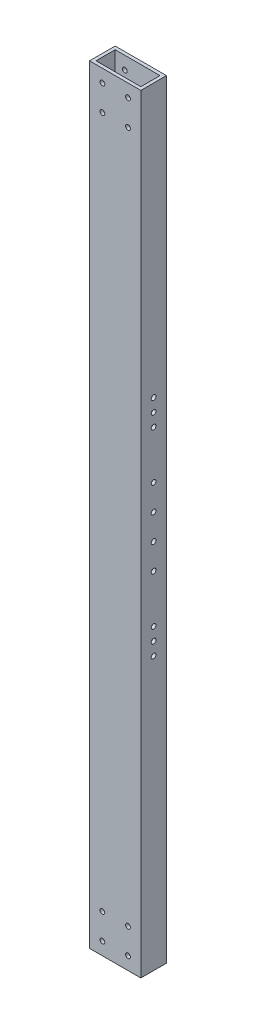
from build123d import *

# Parameters (mm, degrees)
SKETCH1_W               = 50.8
SKETCH1_H               = 25.4
BOSS_EXTRUDE1_DEPTH     = 381
SHELL1_T                = -3.175
SKETCH4_R               = 2.38125
CUT_EXTRUDE1_DEPTH      = 385.581499815
CUT_EXTRUDE2_DEPTH      = 383.689587002
CUT_EXTRUDE2_DEPTH_BACK = 383.689587002
SKETCH5_R               = 2.38125


with BuildPart() as part:
    # Sketch1 → Boss-Extrude1 (new, symmetric)
    with BuildSketch(Plane(origin=(0, 0, 0), x_dir=(1, 0, 0), z_dir=(0, 1, 0))):
        Rectangle(SKETCH1_W, SKETCH1_H)
    extrude(amount=BOSS_EXTRUDE1_DEPTH, both=True)

    # Shell1
    shell1_openings = [part.faces().sort_by_distance(p)[0] for p in [
        (0, 381, 0),
        (0, -381, 0),
    ]]
    offset(amount=SHELL1_T, openings=shell1_openings, kind=Kind.INTERSECTION)

    # Sketch4 → Cut-Extrude1 (cut, through all)
    with BuildSketch(Plane(origin=(25.4, 0, 0), x_dir=(0, 0, -1), z_dir=(1, 0, 0))):
        with Locations((0, 110.9345)):
            Circle(SKETCH4_R)
        with Locations((0, 98.2345)):
            Circle(SKETCH4_R)
        with Locations((0, 85.5345)):
            Circle(SKETCH4_R)
        with Locations(Location((0, -85.5345, 0), (0, 0, 180))):
            Circle(SKETCH4_R)
        with Locations(Location((0, -98.2345, 0), (0, 0, 180))):
            Circle(SKETCH4_R)
        with Locations(Location((0, -110.9345, 0), (0, 0, 180))):
            Circle(SKETCH4_R)
        with Locations((0, -12.7)):
            Circle(SKETCH4_R)
        with Locations((0, -38.1)):
            Circle(SKETCH4_R)
        with Locations(Location((0, 38.1, 0), (0, 0, 180))):
            Circle(SKETCH4_R)
        with Locations(Location((0, 12.7, 0), (0, 0, 180))):
            Circle(SKETCH4_R)
    extrude(amount=-CUT_EXTRUDE1_DEPTH, mode=Mode.SUBTRACT)

    # Sketch5 → Cut-Extrude2 (cut, two sides: drawn at the far end of the back side and taken through both)
    with BuildSketch(Plane.XY.offset(12.7).offset(-CUT_EXTRUDE2_DEPTH_BACK)):
        with Locations((-12.7, 368.3)):
            Circle(SKETCH5_R)
        with Locations((12.7, 368.3)):
            Circle(SKETCH5_R)
        with Locations((12.7, 342.9)):
            Circle(SKETCH5_R)
        with Locations((-12.7, 342.9)):
            Circle(SKETCH5_R)
        with Locations((-12.7, -342.9)):
            Circle(SKETCH5_R)
        with Locations((12.7, -342.9)):
            Circle(SKETCH5_R)
        with Locations((12.7, -368.3)):
            Circle(SKETCH5_R)
        with Locations((-12.7, -368.3)):
            Circle(SKETCH5_R)
    extrude(amount=CUT_EXTRUDE2_DEPTH + CUT_EXTRUDE2_DEPTH_BACK, mode=Mode.SUBTRACT)


solid = part.part
